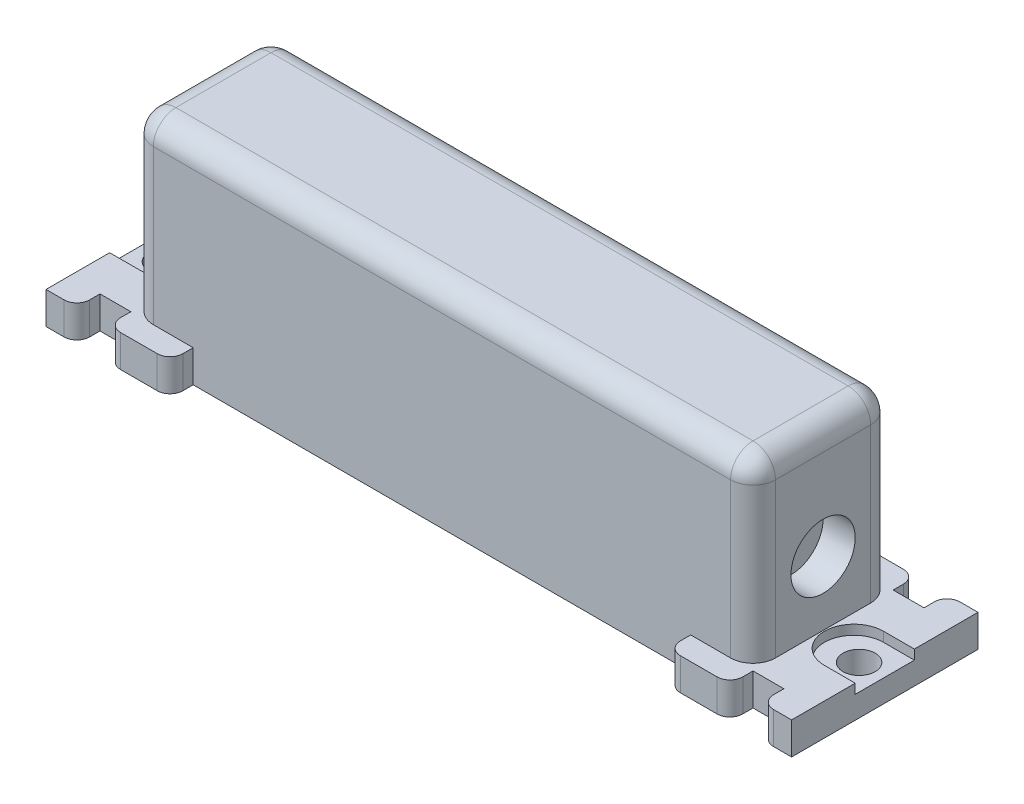
from build123d import *

# Parameters (mm, degrees)
EXTRUDE_2_DEPTH          = 5
EXTRUDE_3_DEPTH          = 27.5
FILLET_1_R               = 3.5
SKETCH_4_R               = 5
CUT_EXTRUDE_1_DEPTH      = 5
CUT_EXTRUDE_2_DEPTH      = 66.80653463
CUT_EXTRUDE_2_DEPTH_BACK = 1.5
SKETCH_6_R               = 2.5
CUT_EXTRUDE_3_DEPTH      = 10


with BuildPart() as part:
    # ｽｹｯﾁ1 → ﾎﾞｽ - 押し出し2 (new body)
    with BuildSketch(Plane(origin=(0, 0, 0), x_dir=(1, 0, 0), z_dir=(0, 1, 0))):
        with BuildLine():
            Line((-58, -14.5), (-58, 14.5))
            Line((-58, 14.5), (-55.2, 14.5))
            ThreePointArc((-55.2, 14.5), (-53.785786438, 13.914213562), (-53.2, 12.5))
            Line((-53.2, 12.5), (-53.2, 10.9))
            Line((-53.2, 10.9), (-48.4, 10.9))
            Line((-48.4, 10.9), (-48.4, 12.5))
            ThreePointArc((-48.4, 12.5), (-47.814213562, 13.914213562), (-46.4, 14.5))
            Line((-46.4, 14.5), (-40.7, 14.5))
            ThreePointArc((-40.7, 14.5), (-39.285786438, 13.914213562), (-38.7, 12.5))
            Line((-38.7, 12.5), (-38.7, 10.9))
            Line((-38.7, 10.9), (38.7, 10.9))
            Line((38.7, 10.9), (38.7, 12.5))
            ThreePointArc((38.7, 12.5), (39.285786438, 13.914213562), (40.7, 14.5))
            Line((40.7, 14.5), (46.4, 14.5))
            ThreePointArc((46.4, 14.5), (47.814213562, 13.914213562), (48.4, 12.5))
            Line((48.4, 12.5), (48.4, 10.9))
            Line((48.4, 10.9), (53.2, 10.9))
            Line((53.2, 10.9), (53.2, 12.5))
            ThreePointArc((53.2, 12.5), (53.785786438, 13.914213562), (55.2, 14.5))
            Line((55.2, 14.5), (58, 14.5))
            Line((58, 14.5), (58, -14.5))
            Line((58, -14.5), (55.2, -14.5))
            ThreePointArc((55.2, -14.5), (53.785786438, -13.914213562), (53.2, -12.5))
            Line((53.2, -12.5), (53.2, -10.9))
            Line((53.2, -10.9), (48.4, -10.9))
            Line((48.4, -10.9), (48.4, -12.5))
            ThreePointArc((48.4, -12.5), (47.814213562, -13.914213562), (46.4, -14.5))
            Line((46.4, -14.5), (40.7, -14.5))
            ThreePointArc((40.7, -14.5), (39.285786438, -13.914213562), (38.7, -12.5))
            Line((38.7, -12.5), (38.7, -10.9))
            Line((38.7, -10.9), (-38.7, -10.9))
            Line((-38.7, -10.9), (-38.7, -12.5))
            ThreePointArc((-38.7, -12.5), (-39.285786438, -13.914213562), (-40.7, -14.5))
            Line((-40.7, -14.5), (-46.4, -14.5))
            ThreePointArc((-46.4, -14.5), (-47.814213562, -13.914213562), (-48.4, -12.5))
            Line((-48.4, -12.5), (-48.4, -10.9))
            Line((-48.4, -10.9), (-53.2, -10.9))
            Line((-53.2, -10.9), (-53.2, -12.5))
            ThreePointArc((-53.2, -12.5), (-53.785786438, -13.914213562), (-55.2, -14.5))
            Line((-55.2, -14.5), (-58, -14.5))
        make_face()
    extrude(amount=EXTRUDE_2_DEPTH)

    # ｽｹｯﾁ3 → ﾎﾞｽ - 押し出し3 (add)
    with BuildSketch(Plane(origin=(0, 5, 0), x_dir=(1, 0, 0), z_dir=(0, 1, 0))):
        with BuildLine():
            Line((-44.9, 10.9), (44.9, 10.9))
            ThreePointArc((44.9, 10.9), (47.374873734, 9.874873734), (48.4, 7.4))
            Line((48.4, 7.4), (48.4, -7.4))
            ThreePointArc((48.4, -7.4), (47.374873734, -9.874873734), (44.9, -10.9))
            Line((44.9, -10.9), (-44.9, -10.9))
            ThreePointArc((-44.9, -10.9), (-47.374873734, -9.874873734), (-48.4, -7.4))
            Line((-48.4, -7.4), (-48.4, 7.4))
            ThreePointArc((-48.4, 7.4), (-47.374873734, 9.874873734), (-44.9, 10.9))
        make_face()
    extrude(amount=EXTRUDE_3_DEPTH)

    # ﾌｨﾚｯﾄ1
    fillet_1_edges = [part.edges().sort_by_distance(p)[0] for p in [
        (47.374873734, 32.5, -9.874873734),
        (0, 32.5, -10.9),
        (-47.374873734, 32.5, -9.874873734),
        (-48.4, 32.5, 0),
        (-47.374873734, 32.5, 9.874873734),
        (0, 32.5, 10.9),
        (47.374873734, 32.5, 9.874873734),
        (48.4, 32.5, 0),
    ]]
    fillet(fillet_1_edges, radius=FILLET_1_R)

    # ｽｹｯﾁ4 → ｶｯﾄ - 押し出し1 (cut)
    with BuildSketch(Plane.ZY.offset(48.4)):
        with Locations((0, 15)):
            Circle(SKETCH_4_R)
    cut_extrude_1 = extrude(amount=-CUT_EXTRUDE_1_DEPTH, mode=Mode.SUBTRACT)

    # ﾐﾗｰ1: ｶｯﾄ - 押し出し1 across plane
    add(cut_extrude_1.mirror(Plane(origin=(0, 0, 0), x_dir=(0, 0, 1), z_dir=(1, 0, 0))), mode=Mode.SUBTRACT)

    # ｽｹｯﾁ5 → ｶｯﾄ - 押し出し2 (cut, two sides: drawn at the far end of the back side and taken through both)
    with BuildSketch(Plane(origin=(0, 5, 0), x_dir=(1, 0, 0), z_dir=(0, 1, 0)).offset(-CUT_EXTRUDE_2_DEPTH_BACK)):
        with BuildLine():
            Line((-53.2, -4.6), (-58, -4.6))
            Line((-58, -4.6), (-58, 4.6))
            Line((-58, 4.6), (-53.2, 4.6))
            ThreePointArc((-53.2, 4.6), (-48.6, 0), (-53.2, -4.6))
        make_face()
        with BuildLine():
            Line((58, -4.6), (58, 4.6))
            Line((58, 4.6), (53.2, 4.6))
            ThreePointArc((53.2, 4.6), (48.6, 0), (53.2, -4.6))
            Line((53.2, -4.6), (58, -4.6))
        make_face()
    extrude(amount=CUT_EXTRUDE_2_DEPTH + CUT_EXTRUDE_2_DEPTH_BACK, mode=Mode.SUBTRACT)

    # ｽｹｯﾁ6 → ｶｯﾄ - 押し出し3 (cut)
    with BuildSketch(Plane(origin=(0, 3.5, 0), x_dir=(1, 0, 0), z_dir=(0, 1, 0))):
        with Locations(Location((-54, 0, 0), (0, 0, 270))):
            Circle(SKETCH_6_R)
        with Locations(Location((54, 0, 0), (0, 0, 270))):
            Circle(SKETCH_6_R)
    extrude(amount=-CUT_EXTRUDE_3_DEPTH, mode=Mode.SUBTRACT)


solid = part.part
